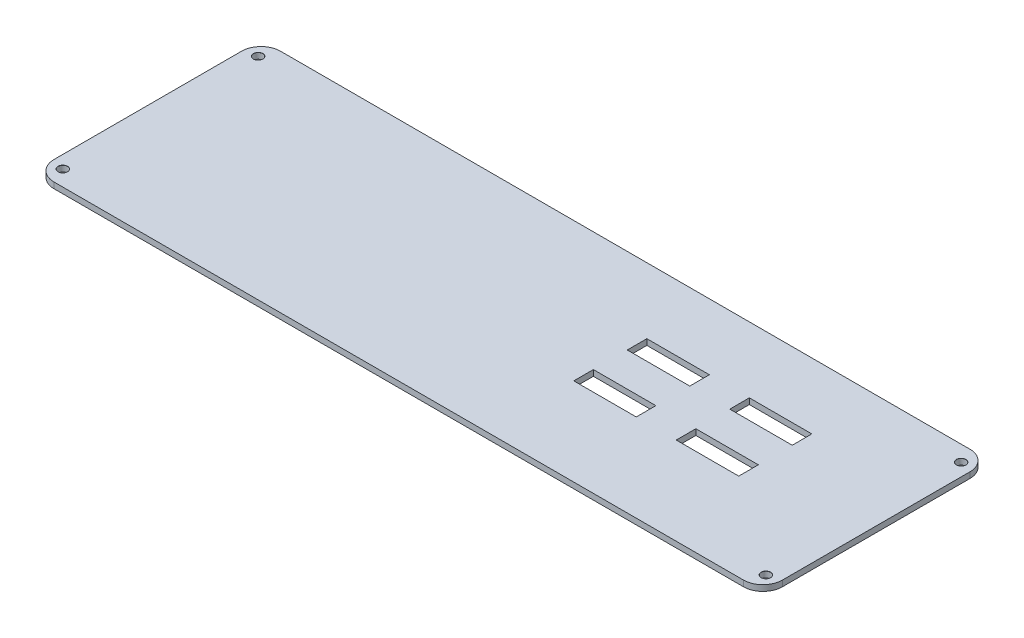
from build123d import *

# Parameters (mm, degrees)
SKETCH1_W                      = 186.5
SKETCH1_H                      = 58
BOSS_EXTRUDE1_DEPTH            = 1.5
FILLET1_R                      = 5
M2_CLEARANCE_HOLE1_D           = 2.4
M2_CLEARANCE_HOLE1_CSINK_D     = 2.45
M2_CLEARANCE_HOLE1_CSINK_ANGLE = 90
SKETCH4_W                      = 16
SKETCH4_H                      = 5.015455786
CUT_EXTRUDE1_DEPTH             = 98.666844425


with BuildPart() as part:
    # Sketch1 → Boss-Extrude1 (new body)
    with BuildSketch(Plane(origin=(0, 0, 0), x_dir=(1, 0, 0), z_dir=(0, 1, 0))):
        Rectangle(SKETCH1_W, SKETCH1_H)
    extrude(amount=BOSS_EXTRUDE1_DEPTH)

    # Fillet1
    fillet1_edges = [part.edges().sort_by_distance(p)[0] for p in [
        (-93.25, 0.75, -29),
        (93.25, 0.75, -29),
        (93.25, 0.75, 29),
        (-93.25, 0.75, 29),
    ]]
    fillet(fillet1_edges, radius=FILLET1_R)

    # M2 Clearance Hole1 (through all)
    with Locations(Plane(origin=(0, 1.5, 0), x_dir=(1, 0, 0), z_dir=(0, 1, 0))):
        with Locations((-90, 25), (90, 25), (90, -25), (-90, -25)):
            CounterSinkHole(M2_CLEARANCE_HOLE1_D / 2, M2_CLEARANCE_HOLE1_CSINK_D / 2, counter_sink_angle=M2_CLEARANCE_HOLE1_CSINK_ANGLE)

    # Sketch4 → Cut-Extrude1 (cut, through all)
    with BuildSketch(Plane(origin=(0, 1.5, 0), x_dir=(1, 0, 0), z_dir=(0, 1, 0))):
        with Locations((30.376648893, 9.645107281)):
            Rectangle(SKETCH4_W, SKETCH4_H)
        with Locations((56.611340698, 9.645107281)):
            Rectangle(SKETCH4_W, SKETCH4_H)
        with Locations((30.376648893, -4.050945058)):
            Rectangle(SKETCH4_W, SKETCH4_H)
        with Locations((56.611340698, -4.050945058)):
            Rectangle(SKETCH4_W, SKETCH4_H)
    extrude(amount=-CUT_EXTRUDE1_DEPTH, mode=Mode.SUBTRACT)


solid = part.part
